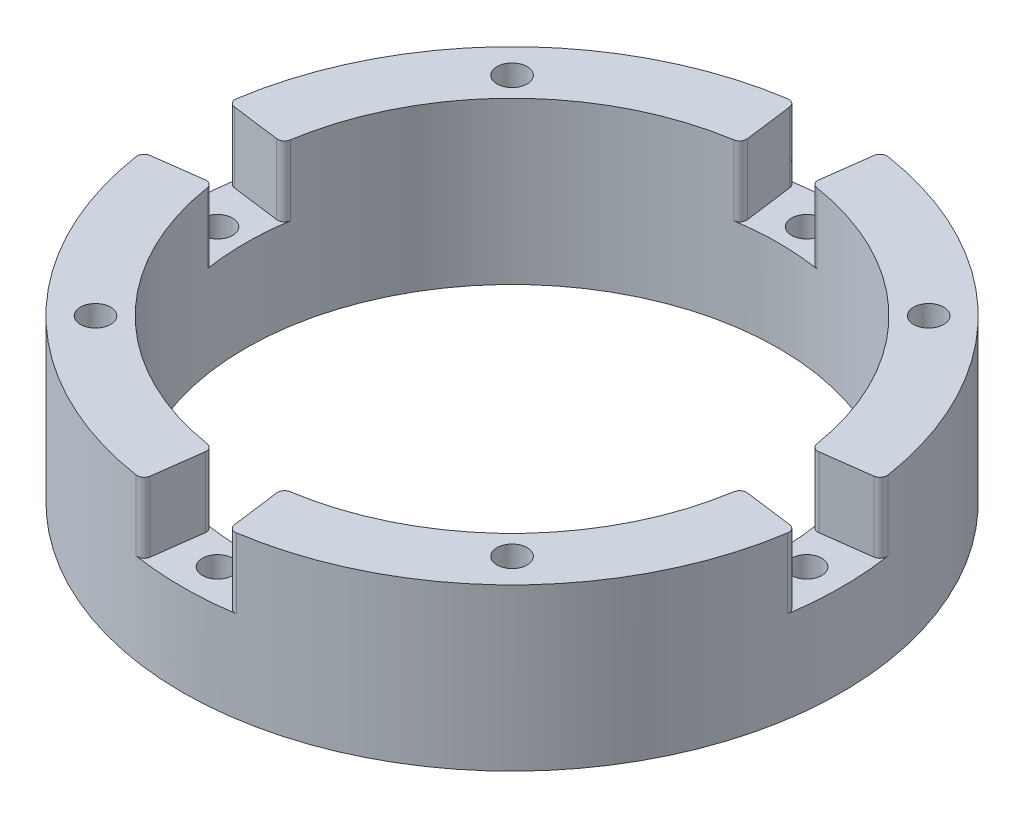
from build123d import *

# Parameters (mm, degrees)
SKETCH1_R                = 47
SKETCH1_R_2              = 38
SKETCH1_R_3              = 2.15
BOSS_EXTRUDE1_DEPTH      = 11.5
CUT_EXTRUDE1_DEPTH       = 10
FILLET1_R                = 1
CIRPATTERN1_COUNT        = 4
CIRPATTERN1_ANGLE        = 270
FILLET1_OF_CIRPATTERN1_R = 1


with BuildPart() as part:
    # Sketch1 → Boss-Extrude1 (new, symmetric)
    with BuildSketch(Plane(origin=(0, 0, 0), x_dir=(1, 0, 0), z_dir=(0, 1, 0))):
        with Locations(Location((0, 0, 0), (0, 0, 270))):
            Circle(SKETCH1_R)
        with Locations(Location((0, 0, 0), (0, 0, 270))):
            Circle(SKETCH1_R_2, mode=Mode.SUBTRACT)
        with Locations(Location((0, 42, 0), (0, 0, 270))):
            Circle(SKETCH1_R_3, mode=Mode.SUBTRACT)
        with Locations(Location((29.69848481, 29.69848481, 0), (0, 0, 270))):
            Circle(SKETCH1_R_3, mode=Mode.SUBTRACT)
        with Locations(Location((42, 0, 0), (0, 0, 270))):
            Circle(SKETCH1_R_3, mode=Mode.SUBTRACT)
        with Locations(Location((29.69848481, -29.69848481, 0), (0, 0, 270))):
            Circle(SKETCH1_R_3, mode=Mode.SUBTRACT)
        with Locations(Location((0, -42, 0), (0, 0, 270))):
            Circle(SKETCH1_R_3, mode=Mode.SUBTRACT)
        with Locations(Location((-29.69848481, -29.69848481, 0), (0, 0, 270))):
            Circle(SKETCH1_R_3, mode=Mode.SUBTRACT)
        with Locations(Location((-42, 0, 0), (0, 0, 270))):
            Circle(SKETCH1_R_3, mode=Mode.SUBTRACT)
        with Locations(Location((-29.69848481, 29.69848481, 0), (0, 0, 270))):
            Circle(SKETCH1_R_3, mode=Mode.SUBTRACT)
    extrude(amount=BOSS_EXTRUDE1_DEPTH, both=True)

    # Sketch2 → Cut-Extrude1 (cut)
    with BuildSketch(Plane(origin=(0, 11.5, 0), x_dir=(1, 0, 0), z_dir=(0, 1, 0))):
        with BuildLine():
            Line((-6.134731034, 46.597908485), (-4.959995304, 37.674904732))
            ThreePointArc((-4.959995304, 37.674904732), (0, 38), (4.959995304, 37.674904732))
            Line((4.959995304, 37.674904732), (6.134731034, 46.597908485))
            ThreePointArc((6.134731034, 46.597908485), (0, 47), (-6.134731034, 46.597908485))
        make_face()
    cut_extrude1 = extrude(amount=-CUT_EXTRUDE1_DEPTH, mode=Mode.SUBTRACT)

    # Fillet1
    fillet1_edges = [part.edges().sort_by_distance(p)[0] for p in [
        (-6.134731034, 6.5, -46.597908485),
        (6.134731034, 6.5, -46.597908485),
        (4.959995304, 6.5, -37.674904732),
        (-4.959995304, 6.5, -37.674904732),
    ]]
    fillet(fillet1_edges, radius=FILLET1_R)

    # CirPattern1: Cut-Extrude1 ×4 about axis
    cirpattern1_axis = Axis((0, 0, 0), (0, 1, 0))
    for i in range(1, CIRPATTERN1_COUNT):
        add(cut_extrude1.rotate(cirpattern1_axis, i * CIRPATTERN1_ANGLE / (CIRPATTERN1_COUNT - 1)), mode=Mode.SUBTRACT)

    # Fillet1 of CirPattern1
    fillet1_of_cirpattern1_edges = [part.edges().sort_by_distance(p)[0] for p in [
        (-46.597908485, 6.5, 6.134731034),
        (-46.597908485, 6.5, -6.134731034),
        (-37.674904732, 6.5, -4.959995304),
        (-37.674904732, 6.5, 4.959995304),
        (6.134731034, 6.5, 46.597908485),
        (-6.134731034, 6.5, 46.597908485),
        (-4.959995304, 6.5, 37.674904732),
        (4.959995304, 6.5, 37.674904732),
        (46.597908485, 6.5, -6.134731034),
        (46.597908485, 6.5, 6.134731034),
        (37.674904732, 6.5, 4.959995304),
        (37.674904732, 6.5, -4.959995304),
    ]]
    fillet(fillet1_of_cirpattern1_edges, radius=FILLET1_OF_CIRPATTERN1_R)


solid = part.part
